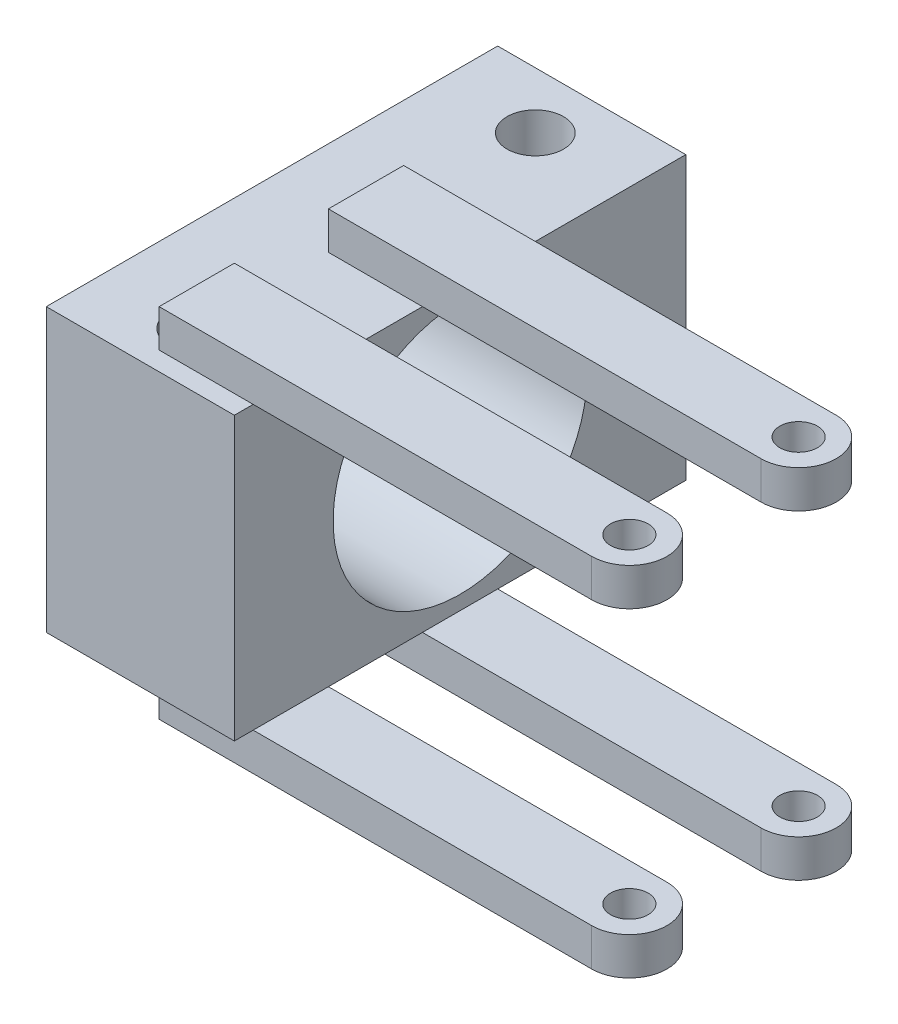
from build123d import *

# Parameters (mm, degrees)
SKETCH2_W               = 10
SKETCH2_H               = 24
SKETCH2_R               = 1.5
BOSS_EXTRUDE1_DEPTH     = 15
SKETCH3_R               = 6.75
CUT_EXTRUDE1_DEPTH      = 10
SKETCH5_R               = 1
BOSS_EXTRUDE2_DEPTH     = 2
MIRROR2_COPY_1_SKETCH_R = 1
MIRROR2_COPY_1_DEPTH    = 2


with BuildPart() as part:
    # Sketch2 → Boss-Extrude1 (new body)
    with BuildSketch(Plane(origin=(0, 0, 0), x_dir=(1, 0, 0), z_dir=(0, 1, 0))):
        Rectangle(SKETCH2_W, SKETCH2_H)
        with Locations(Location((0, 9, 0), (0, 0, 270))):
            Circle(SKETCH2_R, mode=Mode.SUBTRACT)
        with Locations(Location((0, -9, 0), (0, 0, 90))):
            Circle(SKETCH2_R, mode=Mode.SUBTRACT)
    extrude(amount=BOSS_EXTRUDE1_DEPTH)

    # Sketch3 → Cut-Extrude1 (cut)
    with BuildSketch(Plane(origin=(5, 0, 0), x_dir=(0, 0, -1), z_dir=(1, 0, 0))):
        with Locations((0, 7.5)):
            Circle(SKETCH3_R)
    extrude(amount=-CUT_EXTRUDE1_DEPTH, mode=Mode.SUBTRACT)

    # Sketch5 → Boss-Extrude2 (add)
    with BuildSketch(Plane.XZ):
        with BuildLine():
            Line((0, 0), (0, 2))
            Line((0, 2), (23, 2))
            ThreePointArc((23, 2), (25, 0), (23, -2))
            Line((23, -2), (0, -2))
            Line((0, -2), (0, 0))
        make_face()
        with Locations(Location((23, 0, 0), (0, 0, 270))):
            Circle(SKETCH5_R, mode=Mode.SUBTRACT)
    boss_extrude2 = extrude(amount=BOSS_EXTRUDE2_DEPTH)

    # Mirror1: Boss-Extrude2 across plane
    add(boss_extrude2.mirror(Plane(origin=(0, 7.5, 0), x_dir=(0, 0, 1), z_dir=(0, -1, 0))))

    # Mirror2: Boss-Extrude2 across plane
    add(boss_extrude2.mirror(Plane.XY.offset(4.5)))

    # Mirror2 copy 1 sketch → Mirror2 copy 1 (add)
    with BuildSketch(Plane(origin=(0, 15, 9), x_dir=(1, 0, 0), z_dir=(0, 1, 0))):
        with BuildLine():
            Line((0, 0), (0, 2))
            Line((0, 2), (23, 2))
            ThreePointArc((23, 2), (25, 0), (23, -2))
            Line((23, -2), (0, -2))
            Line((0, -2), (0, 0))
        make_face()
        with Locations(Location((23, 0, 0), (0, 0, 270))):
            Circle(MIRROR2_COPY_1_SKETCH_R, mode=Mode.SUBTRACT)
    extrude(amount=MIRROR2_COPY_1_DEPTH)


solid = part.part
